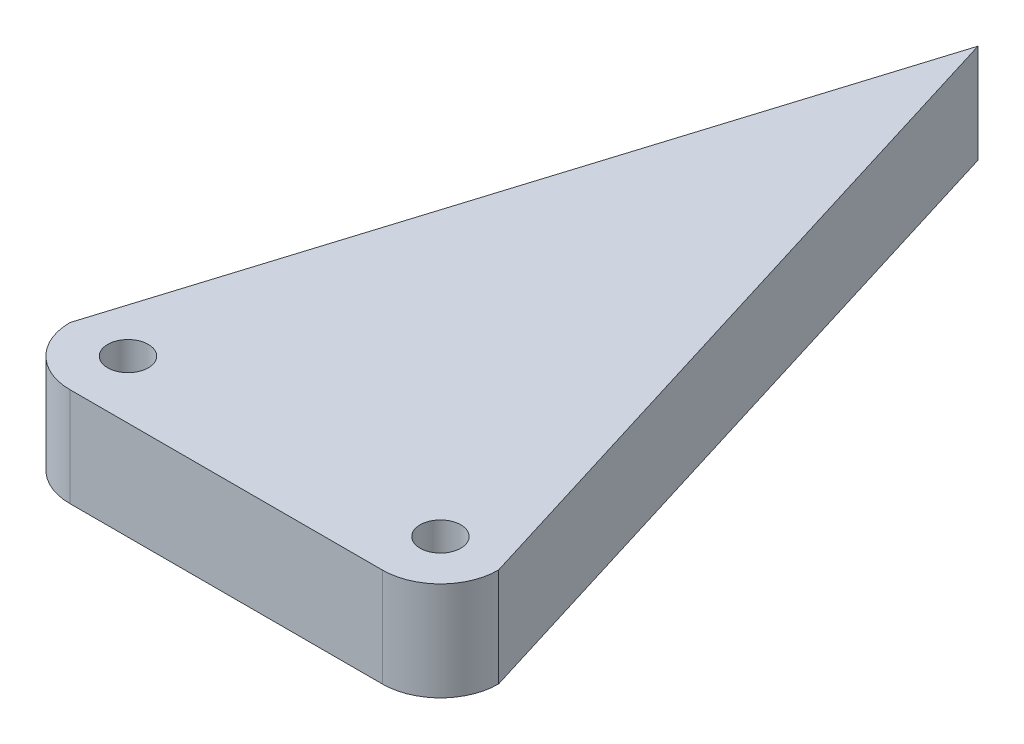
from build123d import *

# Parameters (mm, degrees)
SKETCH1_R           = 1.75
BOSS_EXTRUDE3_DEPTH = 8.5


with BuildPart() as part:
    # Sketch1 → Boss-Extrude3 (new body)
    with BuildSketch(Plane(origin=(0, 0, 0), x_dir=(1, 0, 0), z_dir=(0, 1, 0))):
        with BuildLine():
            Line((-5, 0), (13.479806433, 59.697025207))
            Line((13.479806433, 59.697025207), (31.9, 0))
            ThreePointArc((31.9, 0), (30.435533906, -3.535533906), (26.9, -5))
            Line((26.9, -5), (0, -5))
            ThreePointArc((0, -5), (-3.535533906, -3.535533906), (-5, 0))
        make_face()
        with Locations(Location((0, 0, 0), (0, 0, 270))):
            Circle(SKETCH1_R, mode=Mode.SUBTRACT)
        with Locations(Location((26.9, 0, 0), (0, 0, 270))):
            Circle(SKETCH1_R, mode=Mode.SUBTRACT)
    extrude(amount=BOSS_EXTRUDE3_DEPTH)


solid = part.part
